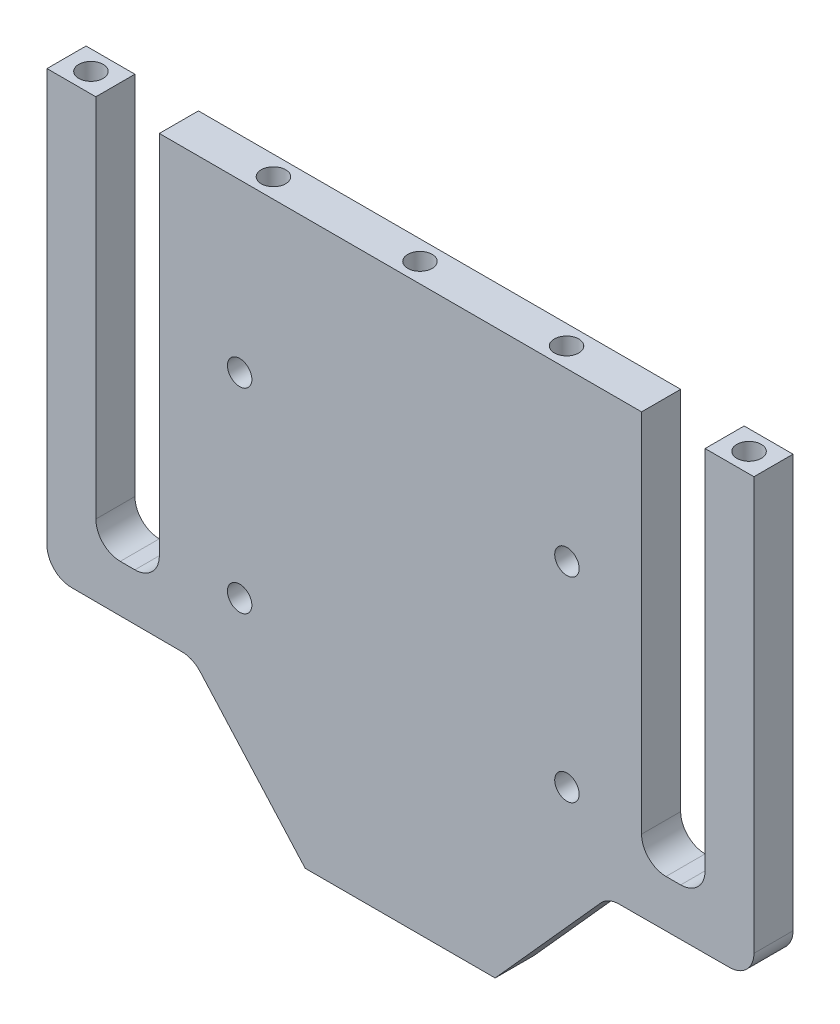
from build123d import *

# Parameters (mm, degrees)
BOSS_EXTRUDE1_DEPTH    = 8
SKETCH2_W              = 45
SKETCH2_H              = 52
CUT_EXTRUDE1_DEPTH     = 342.206659287
SPLIT1_SURFACE_1_BACK  = 343.199
SPLIT1_SURFACE_1_DEPTH = 686.398
SPLIT1_SURFACE_2_BACK  = 343.199
SPLIT1_SURFACE_2_DEPTH = 686.398
SKETCH5_R              = 2.5
CUT_EXTRUDE6_DEPTH     = 5.2
SKETCH4_R              = 2.5
CUT_EXTRUDE7_DEPTH     = 5.2
SKETCH6_R              = 2.5
CUT_EXTRUDE8_DEPTH     = 184.408541223


with BuildPart() as part:
    # Sketch1 → Boss-Extrude1 (new body)
    with BuildSketch(Plane.XY):
        with BuildLine():
            Line((70, 309.985818768), (85.299227191, 309.985818768))
            ThreePointArc((85.299227191, 309.985818768), (88.489017574, 308.836174247), (90.211957942, 305.915913694))
            Line((90.211957942, 305.915913694), (96.672728921, 271.790334282))
            ThreePointArc((96.672728921, 271.790334282), (97.06575438, 270.906904614), (97.621470019, 270.115641625))
            Line((97.621470019, 270.115641625), (139.950460317, 220.786053348))
            ThreePointArc((139.950460317, 220.786053348), (141.739336996, 217.746026552), (142.361429131, 214.274017901))
            Line((142.361429131, 214.274017901), (142.361429131, 30.859943174))
            ThreePointArc((142.361429131, 30.859943174), (140.896963037, 27.324409268), (137.361429131, 25.859943174))
            Line((137.361429131, 25.859943174), (114.717190871, 25.782318449))
            ThreePointArc((114.717190871, 25.782318449), (112.681998989, 25.341726514), (111.002773989, 24.110332733))
            Line((111.002773989, 24.110332733), (89.38285929, 0))
            Line((89.38285929, 0), (50.5, 0))
            Line((50.5, 0), (28.997226011, 24.110332733))
            ThreePointArc((28.997226011, 24.110332733), (27.318001011, 25.341726514), (25.282809129, 25.782318449))
            Line((25.282809129, 25.782318449), (2.638570869, 25.859943174))
            ThreePointArc((2.638570869, 25.859943174), (-0.896963037, 27.324409268), (-2.361429131, 30.859943174))
            Line((-2.361429131, 30.859943174), (-2.361429131, 214.274017901))
            ThreePointArc((-2.361429131, 214.274017901), (-1.739336996, 217.746026552), (0.049539683, 220.786053348))
            Line((0.049539683, 220.786053348), (42.261389271, 270.115641625))
            ThreePointArc((42.261389271, 270.115641625), (42.81710491, 270.906904614), (43.210130369, 271.790334282))
            Line((43.210130369, 271.790334282), (49.724618218, 305.923183314))
            ThreePointArc((49.724618218, 305.923183314), (51.449026762, 308.838533573), (54.635967087, 309.985818768))
            Line((54.635967087, 309.985818768), (70, 309.985818768))
        make_face()
        with BuildLine():
            Line((12.638570869, 35.492492662), (15.638570869, 35.492492662))
            ThreePointArc((15.638570869, 35.492492662), (19.174104775, 36.956958756), (20.638570869, 40.492492662))
            Line((20.638570869, 40.492492662), (20.638570869, 213.625959477))
            Line((20.638570869, 213.625959477), (7.638570869, 213.625959477))
            Line((7.638570869, 213.625959477), (7.638570869, 40.492492662))
            ThreePointArc((7.638570869, 40.492492662), (9.103036963, 36.956958756), (12.638570869, 35.492492662))
        make_face(mode=Mode.SUBTRACT)
        with BuildLine():
            Line((127.361429131, 35.492492662), (124.361429131, 35.492492662))
            ThreePointArc((124.361429131, 35.492492662), (120.825895225, 36.956958756), (119.361429131, 40.492492662))
            Line((119.361429131, 40.492492662), (119.361429131, 213.625959477))
            Line((119.361429131, 213.625959477), (132.361429131, 213.625959477))
            Line((132.361429131, 213.625959477), (132.361429131, 40.492492662))
            ThreePointArc((132.361429131, 40.492492662), (130.896963037, 36.956958756), (127.361429131, 35.492492662))
        make_face(mode=Mode.SUBTRACT)
    extrude(amount=BOSS_EXTRUDE1_DEPTH)

    # Sketch2 → Cut-Extrude1 (cut, through all)
    with BuildSketch(Plane.XY.offset(8)):
        with Locations((69.88285929, 180.008918923)):
            Rectangle(SKETCH2_W, SKETCH2_H)
    extrude(amount=-CUT_EXTRUDE1_DEPTH, mode=Mode.SUBTRACT)


with BuildPart() as body_2:
    # Split1: the piece behind the surface
    add(part.part)
    # Split1 surface: a surface, the sketch's curves swept straight by 686.398 mm
    with BuildLine(Plane(origin=(0, 0, 0), x_dir=(-1, 0, 0), z_dir=(0, 0, -1)).offset(-SPLIT1_SURFACE_1_BACK), mode=Mode.PRIVATE) as split1_surface_1_path:
        Line((-142.361429131, 115.359943174), (2.361429131, 115.359943174))
    split1_surface_1 = Shell.extrude(split1_surface_1_path.wire(), (0 * SPLIT1_SURFACE_1_DEPTH, 0 * SPLIT1_SURFACE_1_DEPTH, -1 * SPLIT1_SURFACE_1_DEPTH))
    split(bisect_by=split1_surface_1, keep=Keep.BOTTOM)

    # Sketch5 → Cut-Extrude6 (cut)
    with BuildSketch(Plane(origin=(0, 115.359943174, -115.359943174), x_dir=(1, 0, 0), z_dir=(0, -1, 0))):
        with Locations(Location((100, 119.359943174, 0), (0, 0, 90))):
            Circle(SKETCH5_R)
        with Locations(Location((2.638570869, 119.359943174, 0), (0, 0, 270))):
            Circle(SKETCH5_R)
        with Locations(Location((40, 119.359943174, 0), (0, 0, 270))):
            Circle(SKETCH5_R)
        with Locations(Location((70, 119.359943174, 0), (0, 0, 270))):
            Circle(SKETCH5_R)
        with Locations(Location((137.361429131, 119.359943174, 0), (0, 0, 270))):
            Circle(SKETCH5_R)
    extrude(amount=CUT_EXTRUDE6_DEPTH, mode=Mode.SUBTRACT)

    # Sketch6 → Cut-Extrude8 (cut, through all)
    with BuildSketch(Plane.XY.offset(8)):
        with Locations((37.078570869, 81.192492662)):
            Circle(SKETCH6_R)
        with Locations((104.078570869, 81.192492662)):
            Circle(SKETCH6_R)
        with Locations((104.078570869, 41.192492662)):
            Circle(SKETCH6_R)
        with Locations((37.078570869, 41.192492662)):
            Circle(SKETCH6_R)
    extrude(amount=-CUT_EXTRUDE8_DEPTH, mode=Mode.SUBTRACT)


with BuildPart() as part_1:
    add(part.part)

    # Split1: split by a surface, the side it looks to stays
    # Split1 surface: a surface, the sketch's curves swept straight by 686.398 mm
    with BuildLine(Plane(origin=(0, 0, 0), x_dir=(-1, 0, 0), z_dir=(0, 0, -1)).offset(-SPLIT1_SURFACE_2_BACK), mode=Mode.PRIVATE) as split1_surface_2_path:
        Line((-142.361429131, 115.359943174), (2.361429131, 115.359943174))
    split1_surface_2 = Shell.extrude(split1_surface_2_path.wire(), (0 * SPLIT1_SURFACE_2_DEPTH, 0 * SPLIT1_SURFACE_2_DEPTH, -1 * SPLIT1_SURFACE_2_DEPTH))
    split(bisect_by=split1_surface_2, keep=Keep.TOP)

    # Sketch4 → Cut-Extrude7 (cut)
    with BuildSketch(Plane(origin=(0, 115.359943174, 0), x_dir=(-1, 0, 0), z_dir=(0, -1, 0))):
        with Locations(Location((-70, -4, 0), (0, 0, 90))):
            Circle(SKETCH4_R)
        with Locations(Location((-40, -4, 0), (0, 0, 90))):
            Circle(SKETCH4_R)
        with Locations(Location((-100, -4, 0), (0, 0, 270))):
            Circle(SKETCH4_R)
        with Locations(Location((-137.361429131, -4, 0), (0, 0, 90))):
            Circle(SKETCH4_R)
        with Locations(Location((-2.638570869, -4, 0), (0, 0, 90))):
            Circle(SKETCH4_R)
    extrude(amount=-CUT_EXTRUDE7_DEPTH, mode=Mode.SUBTRACT)


solid = body_2.part
